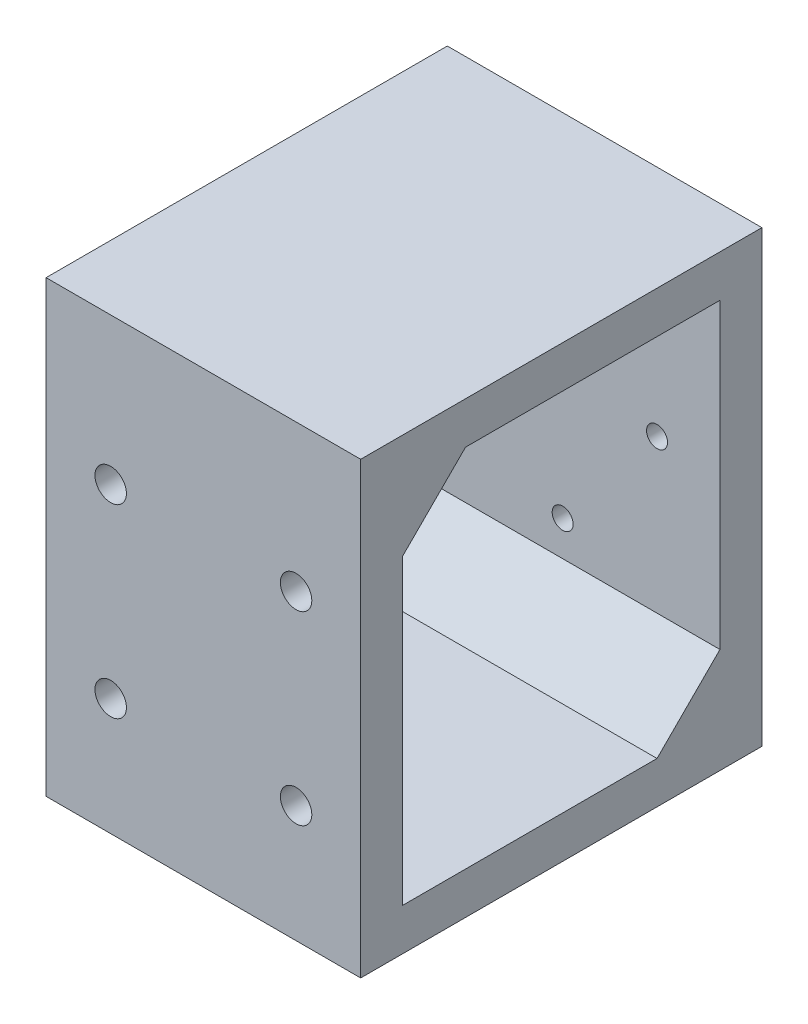
from build123d import *

# Parameters (mm, degrees)
BOSS_EXTRUDE1_DEPTH      = 30
BOSS_EXTRUDE1_DEPTH_BACK = 30
SKETCH1_W                = 76.52
SKETCH1_H                = 85.68
SKETCH1_W_2              = 60.52
SKETCH1_H_2              = 69.68
SKETCH2_R                = 2
CUT_EXTRUDE1_DEPTH       = 30
SKETCH3_R                = 3
CUT_EXTRUDE2_DEPTH       = 30
CHAMFER1_SIZE            = 12


with BuildPart() as part:
    # Sketch1 → Boss-Extrude1 (new, two sides: drawn at the far end of the back side and taken through both)
    with BuildSketch(Plane(origin=(0, 0, 0), x_dir=(0, 0, -1), z_dir=(1, 0, 0)).offset(-BOSS_EXTRUDE1_DEPTH_BACK)):
        with Locations((38.26, 42.84)):
            Rectangle(SKETCH1_W, SKETCH1_H)
        with Locations((38.26, 42.84)):
            Rectangle(SKETCH1_W_2, SKETCH1_H_2, mode=Mode.SUBTRACT)
    extrude(amount=BOSS_EXTRUDE1_DEPTH + BOSS_EXTRUDE1_DEPTH_BACK)

    # Sketch2 → Cut-Extrude1 (cut)
    with BuildSketch(Plane(origin=(0, 0, -76.52), x_dir=(-1, 0, 0), z_dir=(0, 0, -1))):
        with Locations((0, 71.68)):
            Circle(SKETCH2_R)
        with Locations((18, 49.18)):
            Circle(SKETCH2_R)
        with Locations((-18, 49.18)):
            Circle(SKETCH2_R)
        with Locations((0, 26.68)):
            Circle(SKETCH2_R)
    extrude(amount=-CUT_EXTRUDE1_DEPTH, mode=Mode.SUBTRACT)

    # Sketch3 → Cut-Extrude2 (cut)
    with BuildSketch(Plane.XY):
        with Locations((17.67766953, 22.32233047)):
            Circle(SKETCH3_R)
        with Locations((-17.67766953, 22.32233047)):
            Circle(SKETCH3_R)
        with Locations((-17.67766953, 57.67766953)):
            Circle(SKETCH3_R)
        with Locations((17.67766953, 57.67766953)):
            Circle(SKETCH3_R)
    extrude(amount=-CUT_EXTRUDE2_DEPTH, mode=Mode.SUBTRACT)

    # Chamfer1
    chamfer1_edges = [part.edges().sort_by_distance(p)[0] for p in [
        (0, 8, -68.52),
        (0, 77.68, -8),
    ]]
    chamfer(chamfer1_edges, length=CHAMFER1_SIZE)


solid = part.part
